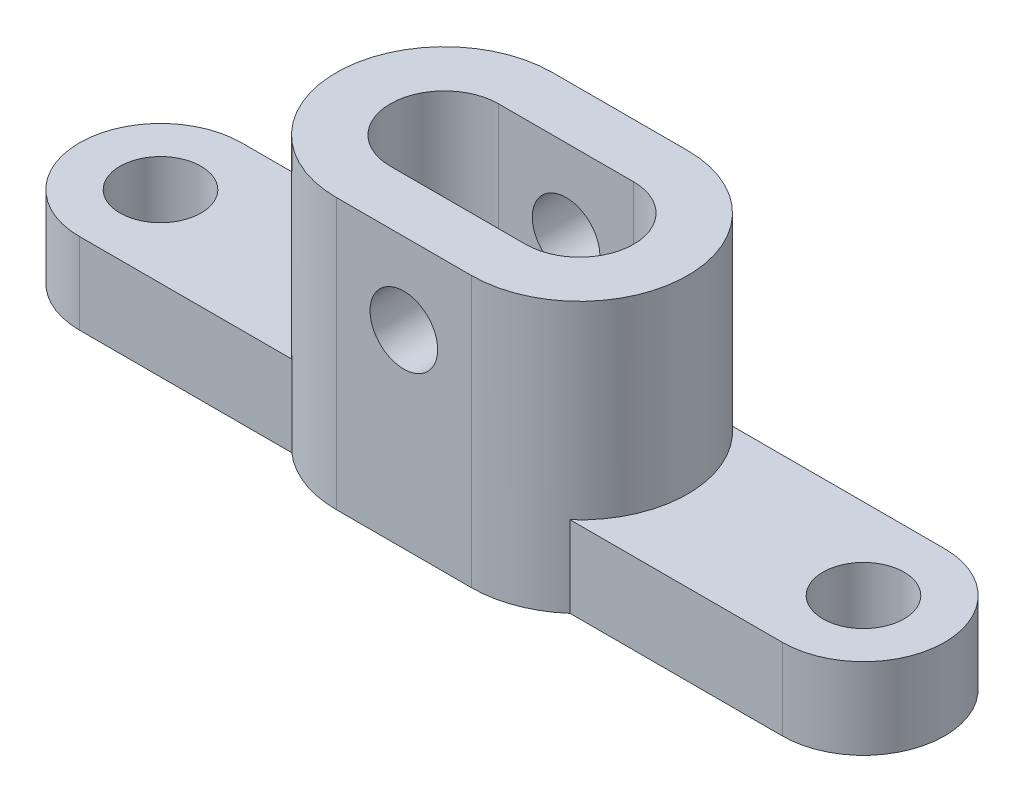
from build123d import *

# Parameters (mm, degrees)
SKETCH_1_R          = 1.5
EXTRUDE_1_DEPTH     = 3
EXTRUDE_2_DEPTH     = 10
SKETCH_7_R          = 1.25
CUT_EXTRUDE_7_DEPTH = 32.701734968
CUT_EXTRUDE_8_DEPTH = 31.935416597


with BuildPart() as part:
    # 草图1 → 凸台-拉伸1 (new body)
    with BuildSketch(Plane(origin=(0, 0, 0), x_dir=(1, 0, 0), z_dir=(0, 1, 0))):
        with BuildLine():
            Line((0, 3), (26, 3))
            ThreePointArc((26, 3), (29, 0), (26, -3))
            Line((26, -3), (0, -3))
            ThreePointArc((0, -3), (-3, 0), (0, 3))
        make_face()
        with Locations(Location((0, 0, 0), (0, 0, 270))):
            Circle(SKETCH_1_R, mode=Mode.SUBTRACT)
        with Locations(Location((26, 0, 0), (0, 0, 270))):
            Circle(SKETCH_1_R, mode=Mode.SUBTRACT)
    extrude(amount=EXTRUDE_1_DEPTH)

    # 草图6 → 凸台-拉伸2 (add)
    with BuildSketch(Plane.XZ):
        with BuildLine():
            Line((10.5, 4), (15.5, 4))
            ThreePointArc((15.5, 4), (19.5, 0), (15.5, -4))
            Line((15.5, -4), (10.5, -4))
            ThreePointArc((10.5, -4), (6.5, 0), (10.5, 4))
        make_face()
    extrude(amount=-EXTRUDE_2_DEPTH)

    # 草图7 → 切除-拉伸7 (cut, through all)
    with BuildSketch(Plane(origin=(0, 0, -4), x_dir=(-1, 0, 0), z_dir=(0, 0, -1))):
        with Locations((-13, 7)):
            Circle(SKETCH_7_R)
    extrude(amount=-CUT_EXTRUDE_7_DEPTH, mode=Mode.SUBTRACT)

    # 草图9 → 切除-拉伸8 (cut, through all)
    with BuildSketch(Plane(origin=(0, 10, 0), x_dir=(1, 0, 0), z_dir=(0, 1, 0))):
        with BuildLine():
            Line((10.5, -2), (15.5, -2))
            ThreePointArc((15.5, -2), (17.5, 0), (15.5, 2))
            Line((15.5, 2), (10.5, 2))
            ThreePointArc((10.5, 2), (8.5, 0), (10.5, -2))
        make_face()
    extrude(amount=-CUT_EXTRUDE_8_DEPTH, mode=Mode.SUBTRACT)


solid = part.part
